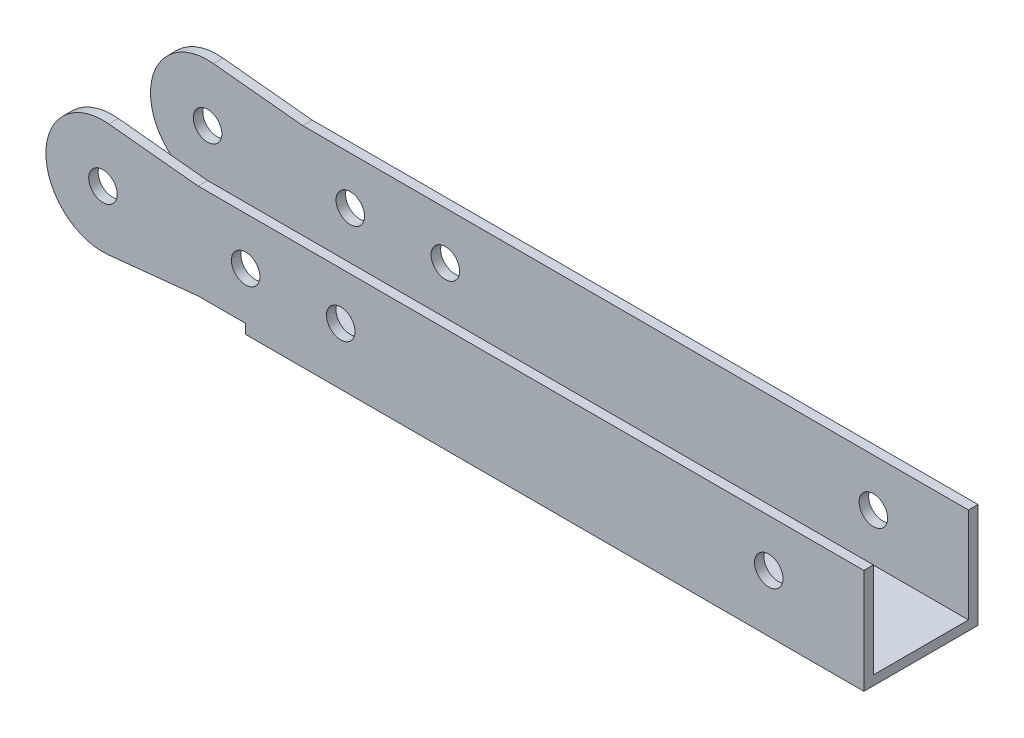
from build123d import *

# Parameters (mm, degrees)
SKETCH_3_R      = 1.5
EXTRUDE_1_DEPTH = 1
SKETCH_1_R      = 1.5
EXTRUDE_2_DEPTH = 1
SKETCH_4_W      = 65
SKETCH_4_H      = 12
EXTRUDE_3_DEPTH = 1


with BuildPart() as part:
    # 草图3 → 凸台-拉伸1 (new body)
    with BuildSketch(Plane.XY.offset(10)):
        with BuildLine():
            Line((-26.8, 8.010393038), (-36.190694621, 8.96898207))
            ThreePointArc((-36.190694621, 8.96898207), (-42.7999991, 2.996713251), (-36.184155472, -2.968310943))
            Line((-36.184155472, -2.968310943), (-26.8, -2))
            Line((-26.8, -2), (43.2, -2))
            Line((43.2, -2), (43.2, 8.010393038))
            Line((43.2, 8.010393038), (-26.8, 8.010393038))
        make_face()
        with Locations((33.2, 3)):
            Circle(SKETCH_3_R, mode=Mode.SUBTRACT)
        with Locations((-11.8, 3)):
            Circle(SKETCH_3_R, mode=Mode.SUBTRACT)
        with Locations((-21.8, 3)):
            Circle(SKETCH_3_R, mode=Mode.SUBTRACT)
        with Locations((-36.8, 3)):
            Circle(SKETCH_3_R, mode=Mode.SUBTRACT)
    extrude(amount=EXTRUDE_1_DEPTH)



with BuildPart() as body_2:
    # 草图1 → 凸台-拉伸2 (new body)
    with BuildSketch(Plane.XY):
        with BuildLine():
            Line((43.2, 8.010393038), (-26.8, 8.010393038))
            Line((-26.8, 8.010393038), (-36.190694621, 8.96898207))
            ThreePointArc((-36.190694621, 8.96898207), (-42.7999991, 2.996713251), (-36.184155472, -2.968310943))
            Line((-36.184155472, -2.968310943), (-26.8, -2))
            Line((-26.8, -2), (43.2, -2))
            Line((43.2, -2), (43.2, 8.010393038))
        make_face()
        with Locations((-36.8, 3)):
            Circle(SKETCH_1_R, mode=Mode.SUBTRACT)
        with Locations((-21.8, 3)):
            Circle(SKETCH_1_R, mode=Mode.SUBTRACT)
        with Locations((-11.8, 3)):
            Circle(SKETCH_1_R, mode=Mode.SUBTRACT)
        with Locations((33.2, 3)):
            Circle(SKETCH_1_R, mode=Mode.SUBTRACT)
    extrude(amount=-EXTRUDE_2_DEPTH)


with BuildPart() as part_1:
    add(part.part)

    add(body_2.part)  # 凸台-拉伸3 merges body 2
    # 草图4 → 凸台-拉伸3 (add)
    with BuildSketch(Plane.XZ.offset(2)):
        with Locations((10.7, 5)):
            Rectangle(SKETCH_4_W, SKETCH_4_H)
    extrude(amount=EXTRUDE_3_DEPTH)


solid = part_1.part
